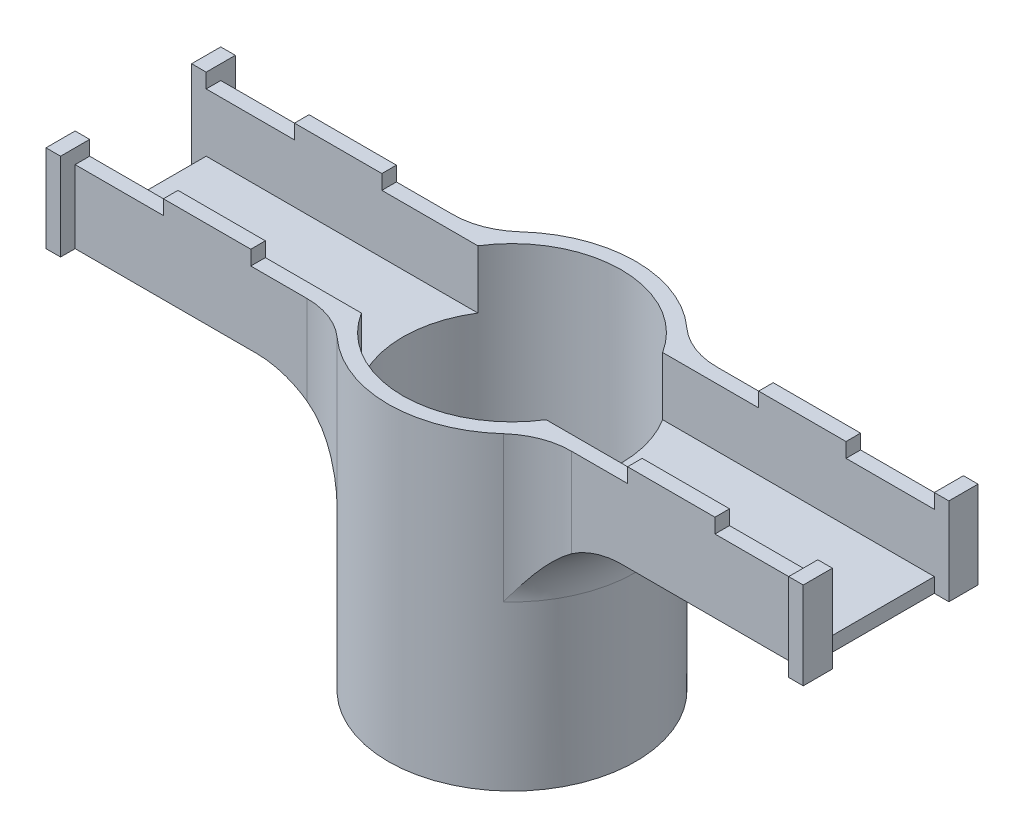
from build123d import *

# Parameters (mm, degrees)
SKETCH_1_R               = 17
SKETCH_1_R_2             = 7
SKETCH_1_R_3             = 1.6
EXTRUDE_1_DEPTH          = 2
EXTRUDE_START            = 40.5
SKETCH_2_R               = 17
SKETCH_2_R_2             = 15
EXTRUDE_2_DEPTH          = 40.5
EXTRUDE_3_REACH          = 82.114
EXTRUDE_3_END_RADIUS     = 17
SKETCH_5_W               = 4
SKETCH_5_H               = 12
EXTRUDE_4_DEPTH          = 2
CUT_EXTRUDE_1_REACH      = 83.143
SKETCH_6_W               = 16
SKETCH_6_H               = 8
SKETCH_7_W               = 12
SKETCH_7_H               = 2
EXTRUDE_5_DEPTH          = 2
MIRROR_2_COPY_1_SKETCH_W = 12
MIRROR_2_COPY_1_SKETCH_H = 2
MIRROR_2_COPY_1_DEPTH    = 2
MIRROR_2_COPY_2_SKETCH_W = 12
MIRROR_2_COPY_2_SKETCH_H = 2
MIRROR_2_COPY_2_DEPTH    = 2
FILLET_1_R               = 10


with BuildPart() as part:
    # 草图1 → 凸台-拉伸1 (new body)
    with BuildSketch(Plane(origin=(0, 0, 0), x_dir=(1, 0, 0), z_dir=(0, 1, 0))):
        with Locations(Location((0, 0, 0), (0, 0, 270))):
            Circle(SKETCH_1_R)
        with Locations(Location((0, 0, 0), (0, 0, 270))):
            Circle(SKETCH_1_R_2, mode=Mode.SUBTRACT)
        with Locations(Location((6.717514421, 6.717514421, 0), (0, 0, 270))):
            Circle(SKETCH_1_R_3, mode=Mode.SUBTRACT)
        with Locations(Location((2.458780928, -9.17629535, 0), (0, 0, 270))):
            Circle(SKETCH_1_R_3, mode=Mode.SUBTRACT)
        with Locations(Location((-9.17629535, 2.458780928, 0), (0, 0, 270))):
            Circle(SKETCH_1_R_3, mode=Mode.SUBTRACT)
    extrude(amount=-EXTRUDE_1_DEPTH)

    # 草图2 → 凸台-拉伸2 (add)
    with BuildSketch(Plane(origin=(0, 0, 0), x_dir=(1, 0, 0), z_dir=(0, 1, 0)).offset(EXTRUDE_START)):
        with Locations(Location((0, 0, 0), (0, 0, 270))):
            Circle(SKETCH_2_R)
        with Locations(Location((0, 0, 0), (0, 0, 270))):
            Circle(SKETCH_2_R_2, mode=Mode.SUBTRACT)
    extrude(amount=-EXTRUDE_2_DEPTH)

    # 凸台-拉伸3: up to this cylinder (the profile starts outside it)
    extrude_3_end = Plane(origin=(0, 40.276393, 0), z_dir=(0, 1, 0)) * Cylinder(EXTRUDE_3_END_RADIUS, 199.228, mode=Mode.PRIVATE)
    # 草图4 → 凸台-拉伸3 (add, up to the surface)
    with BuildSketch(Plane(origin=(50, 0, 0), x_dir=(0, 0, -1), z_dir=(1, 0, 0)), mode=Mode.PRIVATE) as extrude_3_sk1:
        Polygon((-10, 40.5), (-8, 40.5), (-8, 32.5), (8, 32.5), (8, 40.5), (10, 40.5), (10, 30.5), (-10, 30.5), align=None)
    extrude_3_tool1 = extrude(extrude_3_sk1.sketch, amount=-EXTRUDE_3_REACH, mode=Mode.PRIVATE) - extrude_3_end
    extrude_3 = extrude_3_tool1.solids().sort_by_distance((50, 40.276393, 9))[0]
    add(extrude_3)

    # 草图5 → 凸台-拉伸4 (add)
    with BuildSketch(Plane(origin=(50, 0, 0), x_dir=(0, 0, -1), z_dir=(1, 0, 0))):
        with Locations((-10, 36.5)):
            Rectangle(SKETCH_5_W, SKETCH_5_H)
        with Locations((10, 36.5)):
            Rectangle(SKETCH_5_W, SKETCH_5_H)
    extrude_4 = extrude(amount=EXTRUDE_4_DEPTH)

    # 草图6 → 切除-拉伸1 (cut, up to next)
    with BuildSketch(Plane(origin=(50, 0, 0), x_dir=(0, 0, -1), z_dir=(1, 0, 0)), mode=Mode.PRIVATE) as cut_extrude_1_sk1:
        with Locations((0, 36.5)):
            Rectangle(SKETCH_6_W, SKETCH_6_H)
    cut_extrude_1_tool1 = extrude(cut_extrude_1_sk1.sketch, amount=-CUT_EXTRUDE_1_REACH, mode=Mode.PRIVATE) & part.part
    cut_extrude_1 = cut_extrude_1_tool1.solids().sort_by_distance((50, 36.5, 0))[0]
    add(cut_extrude_1, mode=Mode.SUBTRACT)

    # 草图7 → 凸台-拉伸5 (add)
    with BuildSketch(Plane(origin=(0, 40.5, 0), x_dir=(1, 0, 0), z_dir=(0, 1, 0))):
        with Locations((31.873863542, -9)):
            Rectangle(SKETCH_7_W, SKETCH_7_H)
    extrude_5 = extrude(amount=EXTRUDE_5_DEPTH)

    # 镜向1: 凸台-拉伸5 across plane
    add(extrude_5.mirror(Plane.XY))

    # 镜向2: 凸台-拉伸3, 凸台-拉伸4, 切除-拉伸1 across plane
    add(extrude_3.mirror(Plane(origin=(0, 0, 0), x_dir=(0, 0, 1), z_dir=(1, 0, 0))))
    add(extrude_4.mirror(Plane(origin=(0, 0, 0), x_dir=(0, 0, 1), z_dir=(1, 0, 0))))
    add(cut_extrude_1.mirror(Plane(origin=(0, 0, 0), x_dir=(0, 0, 1), z_dir=(1, 0, 0))), mode=Mode.SUBTRACT)

    # 镜向2 copy 1 sketch → 镜向2 copy 1 (add)
    with BuildSketch(Plane(origin=(0, 40.5, 0), x_dir=(-1, 0, 0), z_dir=(0, 1, 0))):
        with Locations((31.873863542, -9)):
            Rectangle(MIRROR_2_COPY_1_SKETCH_W, MIRROR_2_COPY_1_SKETCH_H)
    extrude(amount=MIRROR_2_COPY_1_DEPTH)

    # 镜向2 copy 2 sketch → 镜向2 copy 2 (add)
    with BuildSketch(Plane(origin=(0, 40.5, 0), x_dir=(-1, 0, 0), z_dir=(0, 1, 0))):
        with Locations((31.873863542, 9)):
            Rectangle(MIRROR_2_COPY_2_SKETCH_W, MIRROR_2_COPY_2_SKETCH_H)
    extrude(amount=MIRROR_2_COPY_2_DEPTH)

    # 圆角1
    fillet_1_edges = [part.edges().sort_by_distance(p)[0] for p in [
        (-13.747727085, 35.5, 10),
        (-13.747727085, 35.5, -10),
        (-17, 30.5, 0),
        (13.747727085, 35.5, 10),
        (13.747727085, 35.5, -10),
        (17, 30.5, 0),
    ]]
    fillet(fillet_1_edges, radius=FILLET_1_R)


solid = part.part
